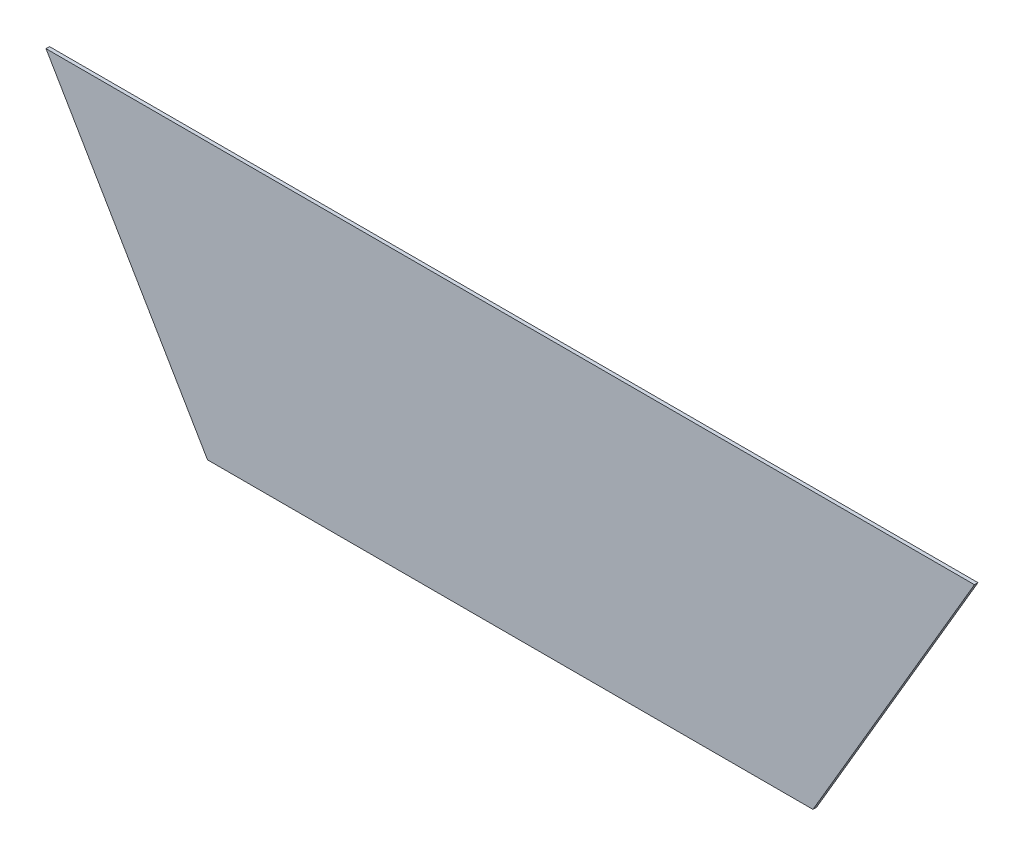
from build123d import *

# Parameters (mm, degrees)
BOSS_EXTRUDE1_DEPTH = 2


with BuildPart() as part:
    # Sketch1 → Boss-Extrude1 (new body)
    with BuildSketch(Plane(origin=(0, 0, 11.943025192), x_dir=(-1, 0, 0), z_dir=(0, 0, -1))):
        Polygon((-171.5, 0), (171.5, 0), (263, 156), (-263, 156), align=None)
    extrude(amount=BOSS_EXTRUDE1_DEPTH)


solid = part.part
